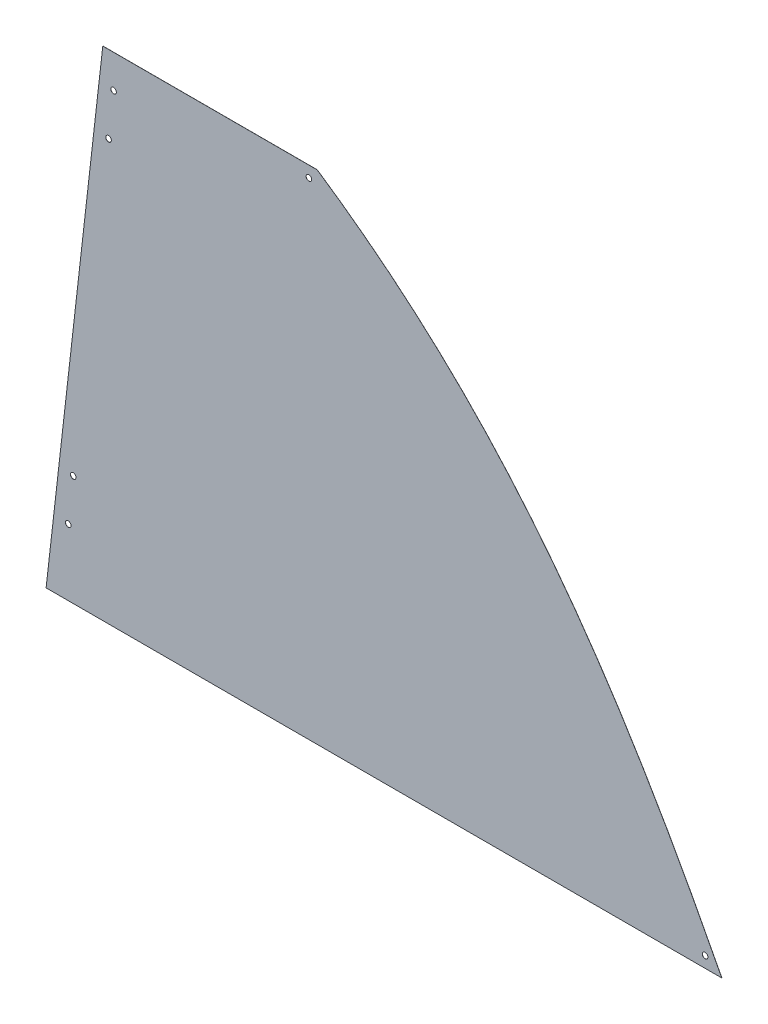
from build123d import *

# Parameters (mm, degrees)
BOSS_EXTRUDE1_DEPTH         = 0.127
BOSS_EXTRUDE2_DEPTH         = 0.127
F_1_4_0_25_DIAMETER_HOLE2_D = 6.35
F_1_4_0_25_DIAMETER_HOLE3_D = 6.35


with BuildPart() as part:
    # Sketch1 → Boss-Extrude1 (new body)
    with BuildSketch(Plane.XY):
        with BuildLine():
            Line((0, 0), (739.14, 0))
            add(Edge.make_bspline(
                [(277.420636668, 567.826315519), (496.859161811, 420.297110317), (620.758181585, 229.590161119), (739.14, 0)],
                knots=[0, 0, 0, 0, 1, 1, 1, 1], degree=3))
            Line((277.420636668, 567.826315519), (64.695636668, 567.826315519))
            Line((64.695636668, 567.826315519), (0, 0))
        make_face()
    extrude(amount=BOSS_EXTRUDE1_DEPTH)

    # Sketch5 → Boss-Extrude2 (add)
    with BuildSketch(Plane(origin=(0, 0, 0), x_dir=(-1, 0, 0), z_dir=(0, 0, -1))):
        Polygon((-64.695636668, 567.826315519), (-32.740222655, 567.826315519), (31.955414013, 0), (0, 0), align=None)
    extrude(amount=-BOSS_EXTRUDE2_DEPTH)

    # 1/4 (0.25) Diameter Hole2 (through all)
    with Locations(Plane.XY.offset(0.127)):
        with Locations((-6.712513837, 75.710175403), (-0.961790578, 126.183625671), (39.293272238, 479.49777755), (45.043995497, 529.971227818)):
            Hole(F_1_4_0_25_DIAMETER_HOLE2_D / 2)

    # 1/4 (0.25) Diameter Hole3 (through all)
    with Locations(Plane.XY.offset(0.127)):
        with Locations((720.09, 12.7), (267.895636668, 555.126315519)):
            Hole(F_1_4_0_25_DIAMETER_HOLE3_D / 2)


solid = part.part
